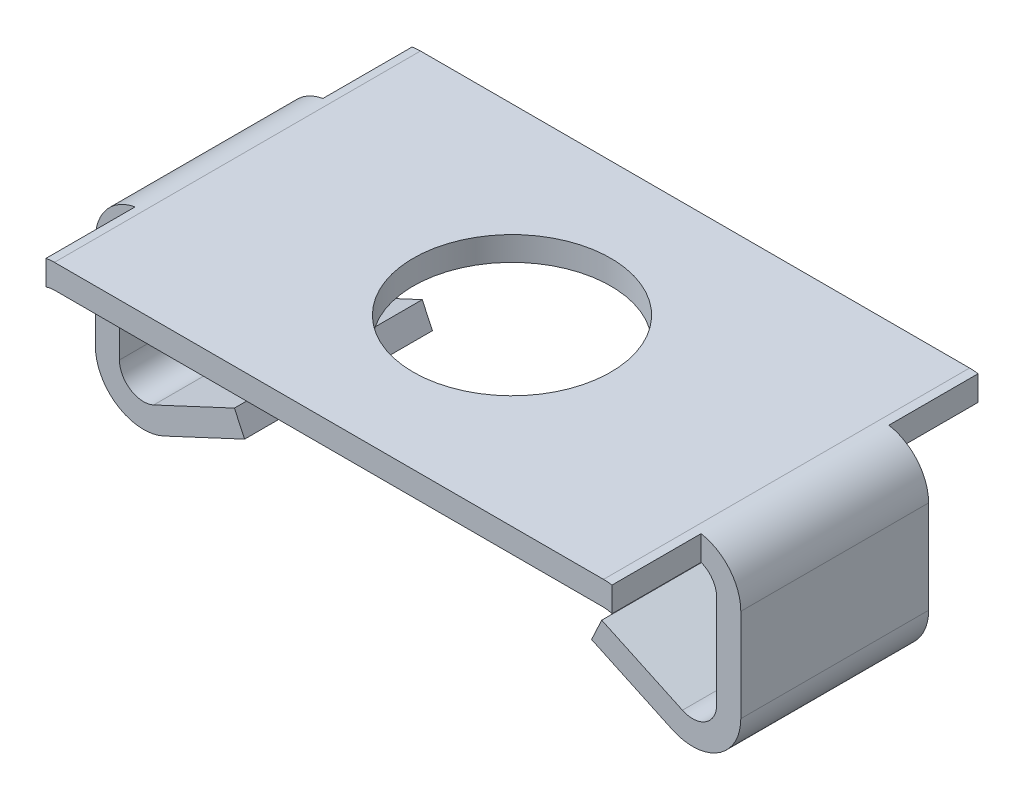
from build123d import *

# Parameters (mm, degrees)
EXTRUDE_1_DEPTH     = 7.6
CUT_EXTRUDE_1_DEPTH = 3.7
SKETCH_5_R          = 4.1
CUT_EXTRUDE_2_DEPTH = 3.7


with BuildPart() as part:
    # 草图1 → 凸台-拉伸1 (new, symmetric)
    with BuildSketch(Plane.XY):
        with BuildLine():
            Line((-7.348183963, -6.11049447), (-10.699512046, -7.67324442))
            ThreePointArc((-10.699512046, -7.67324442), (-12.619347786, -7.547411737), (-13.544748569, -5.860628846))
            Line((-13.544748569, -5.860628846), (-13.544748569, -2))
            ThreePointArc((-13.544748569, -2), (-12.958962131, -0.585786438), (-11.544748569, 0))
            Line((-11.544748569, 0), (11.255251431, 0))
            ThreePointArc((11.255251431, 0), (12.669464993, -0.585786438), (13.255251431, -2))
            Line((13.255251431, -2), (13.255251431, -5.860628846))
            ThreePointArc((13.255251431, -5.860628846), (12.329850648, -7.547411737), (10.410014907, -7.67324442))
            Line((10.410014907, -7.67324442), (7.058686825, -6.11049447))
            Line((7.058686825, -6.11049447), (7.481305087, -5.204186683))
            Line((7.481305087, -5.204186683), (10.832633169, -6.766936633))
            ThreePointArc((10.832633169, -6.766936633), (11.792551039, -6.704020292), (12.255251431, -5.860628846))
            Line((12.255251431, -5.860628846), (12.255251431, -2))
            ThreePointArc((12.255251431, -2), (11.962358212, -1.292893219), (11.255251431, -1))
            Line((11.255251431, -1), (-11.544748569, -1))
            ThreePointArc((-11.544748569, -1), (-12.25185535, -1.292893219), (-12.544748569, -2))
            Line((-12.544748569, -2), (-12.544748569, -5.860628846))
            ThreePointArc((-12.544748569, -5.860628846), (-12.082048177, -6.704020292), (-11.122130307, -6.766936633))
            Line((-11.122130307, -6.766936633), (-7.770802225, -5.204186683))
            Line((-7.770802225, -5.204186683), (-7.348183963, -6.11049447))
        make_face()
    extrude(amount=EXTRUDE_1_DEPTH, both=True)

    # 草图3 → 切除-拉伸1 (cut)
    with BuildSketch(Plane.XY.offset(7.6)):
        Polygon((-11.894748569, -3.292064446), (-5.65074495, -3.292064446), (-5.65074495, -8.789099245), (-21.304410353, -8.789099245), (-21.304410353, 0.944175246), (-11.894748569, 0.944175246), align=None)
        Polygon((5.361247812, -3.292064446), (5.361247812, -8.789099245), (21.014913215, -8.789099245), (21.014913215, 0.944175246), (11.605251431, 0.944175246), (11.605251431, -3.292064446), align=None)
    cut_extrude_1 = extrude(amount=-CUT_EXTRUDE_1_DEPTH, mode=Mode.SUBTRACT)

    # 镜向1: 切除-拉伸1 across plane
    add(cut_extrude_1.mirror(Plane.XY), mode=Mode.SUBTRACT)

    # 草图5 → 切除-拉伸2 (cut)
    with BuildSketch(Plane(origin=(0, 0, 0), x_dir=(1, 0, 0), z_dir=(0, 1, 0))):
        with Locations(Location((-0.144748569, 0, 0), (0, 0, 270))):
            Circle(SKETCH_5_R)
    extrude(amount=-CUT_EXTRUDE_2_DEPTH, mode=Mode.SUBTRACT)


solid = part.part
